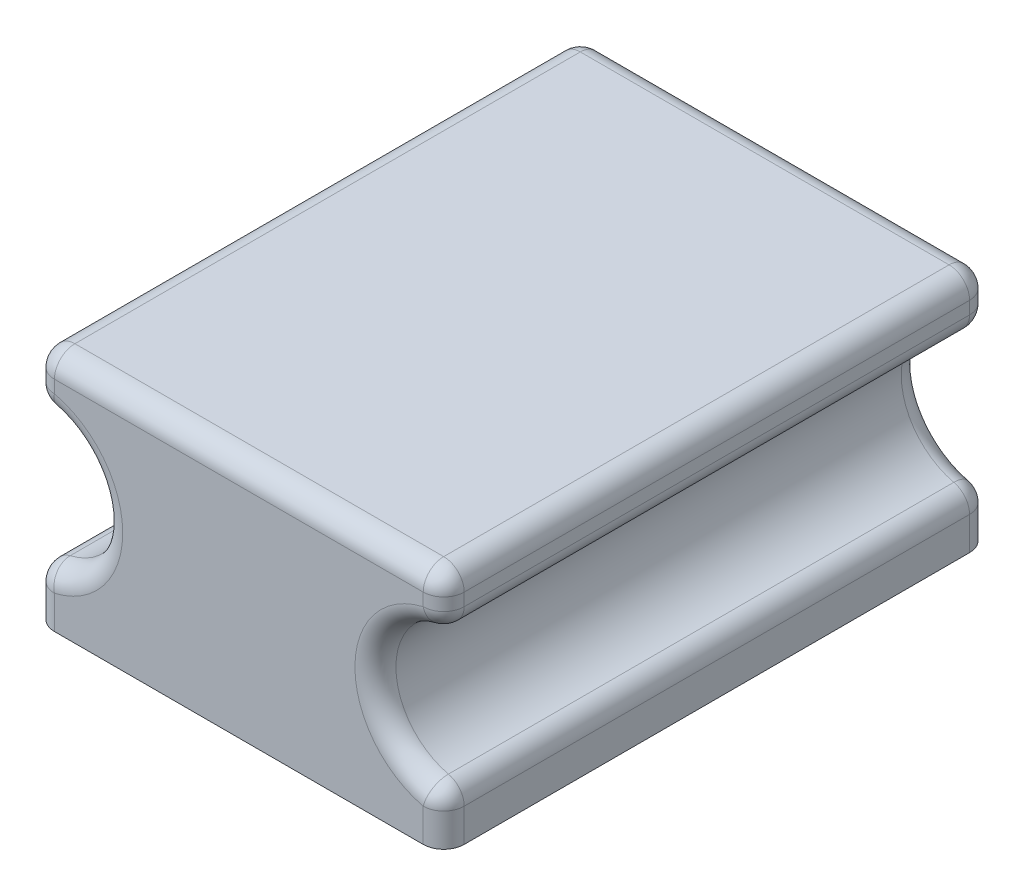
from build123d import *

# Parameters (mm, degrees)
EXTRUDE_1_DEPTH = 40
FILLET_1_R      = 3
FILLET_2_R      = 3


with BuildPart() as part:
    # Эскиз1 → Бобышка-Вытянуть1 (new, symmetric)
    with BuildSketch(Plane.XY):
        with BuildLine():
            Line((-30, 0), (30, 0))
            Line((30, 0), (30, 7.5))
            ThreePointArc((30, 7.5), (20, 17.5), (30, 27.5))
            Line((30, 27.5), (30, 35))
            Line((30, 35), (-30, 35))
            Line((-30, 35), (-30, 27.5))
            ThreePointArc((-30, 27.5), (-20, 17.5), (-30, 7.5))
            Line((-30, 7.5), (-30, 0))
        make_face()
    extrude(amount=EXTRUDE_1_DEPTH, both=True)

    # Скругление1
    fillet_1_edges = [part.edges().sort_by_distance(p)[0] for p in [
        (-30, 7.5, 0),
        (-30, 27.5, 0),
        (-30, 35, 0),
        (30, 35, 0),
        (30, 27.5, 0),
        (30, 7.5, 0),
    ]]
    fillet(fillet_1_edges, radius=FILLET_1_R)

    # Скругление2
    fillet_2_edges = [part.edges().sort_by_distance(p)[0] for p in [
        (30, 2.42544468, 40),
        (20, 17.5, -40),
        (20, 17.5, 40),
        (-30, 2.42544468, -40),
        (-20, 17.5, -40),
        (-30, 31.07455532, -40),
        (0, 35, -40),
        (30, 31.07455532, -40),
        (29.121320344, 34.121320344, -40),
        (-29.121320344, 34.121320344, -40),
        (29.353393622, 28.288589622, -40),
        (-29.353393622, 28.288589622, -40),
        (-29.353393622, 6.711410378, -40),
        (29.353393622, 6.711410378, -40),
        (-30, 2.42544468, 40),
        (30, 31.07455532, 40),
        (0, 35, 40),
        (-30, 31.07455532, 40),
        (-20, 17.5, 40),
        (29.121320344, 34.121320344, 40),
        (-29.121320344, 34.121320344, 40),
        (29.353393622, 28.288589622, 40),
        (-29.353393622, 28.288589622, 40),
        (-29.353393622, 6.711410378, 40),
        (29.353393622, 6.711410378, 40),
        (30, 2.42544468, -40),
    ]]
    fillet(fillet_2_edges, radius=FILLET_2_R)


solid = part.part
